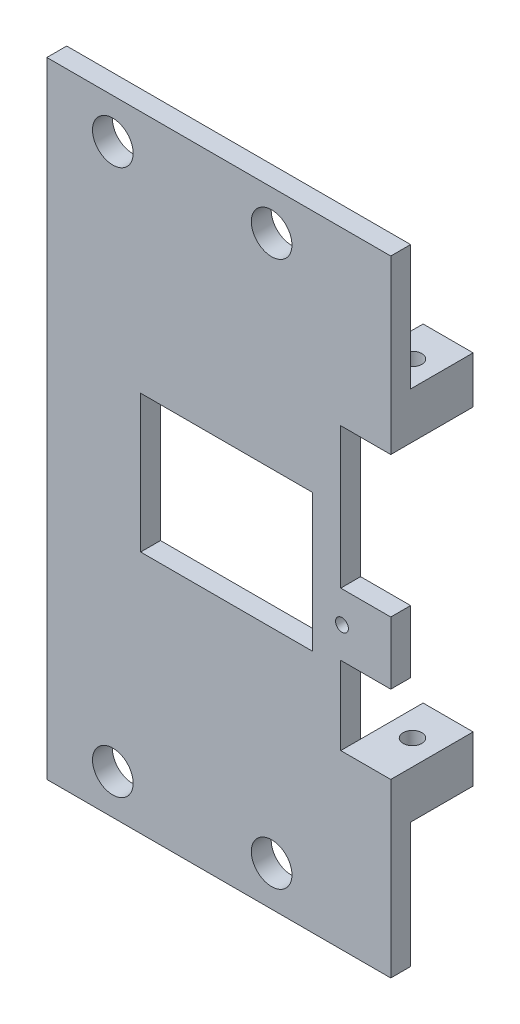
from build123d import *

# Parameters (mm, degrees)
SKETCH1_W           = 55
SKETCH1_H           = 100
SKETCH1_W_2         = 27.5
SKETCH1_H_2         = 22
BOSS_EXTRUDE1_DEPTH = 3.175
SKETCH2_W           = 8
SKETCH2_H           = 60
BOSS_EXTRUDE2_DEPTH = 10
SKETCH3_W           = 8
SKETCH3_H           = 45
CUT_EXTRUDE1_DEPTH  = 10
SKETCH4_R           = 1.5
CUT_EXTRUDE2_DEPTH  = 119.348003785
SKETCH5_R           = 3.25
CUT_EXTRUDE3_DEPTH  = 108.993055332
SKETCH7_W           = 8
SKETCH7_H           = 45
CUT_EXTRUDE5_DEPTH  = 108.993055332
SKETCH8_W           = 3.175
SKETCH8_H           = 10
BOSS_EXTRUDE4_DEPTH = 8
SKETCH9_R           = 1.025
CUT_EXTRUDE6_DEPTH  = 108.993055332


with BuildPart() as part:
    # Sketch1 → Boss-Extrude1 (new body)
    with BuildSketch(Plane.XY):
        with Locations((35, -37.5)):
            Rectangle(SKETCH1_W, SKETCH1_H)
        with Locations((36.25, -37.5)):
            Rectangle(SKETCH1_W_2, SKETCH1_H_2, mode=Mode.SUBTRACT)
    extrude(amount=BOSS_EXTRUDE1_DEPTH)

    # Sketch2 → Boss-Extrude2 (add)
    with BuildSketch(Plane(origin=(0, 0, 0), x_dir=(-1, 0, 0), z_dir=(0, 0, -1))):
        with Locations((-58.5, -37.5)):
            Rectangle(SKETCH2_W, SKETCH2_H)
    extrude(amount=BOSS_EXTRUDE2_DEPTH)

    # Sketch3 → Cut-Extrude1 (cut)
    with BuildSketch(Plane(origin=(0, 0, -10), x_dir=(-1, 0, 0), z_dir=(0, 0, -1))):
        with Locations((-58.5, -37.5)):
            Rectangle(SKETCH3_W, SKETCH3_H)
    extrude(amount=-CUT_EXTRUDE1_DEPTH, mode=Mode.SUBTRACT)

    # Sketch4 → Cut-Extrude2 (cut, through all)
    with BuildSketch(Plane(origin=(0, 12.5, 0), x_dir=(1, 0, 0), z_dir=(0, 1, 0))):
        with Locations(Location((58.5, 4.3, 0), (0, 0, 270))):
            Circle(SKETCH4_R)
    extrude(amount=-CUT_EXTRUDE2_DEPTH, mode=Mode.SUBTRACT)

    # Sketch5 → Cut-Extrude3 (cut, through all)
    with BuildSketch(Plane(origin=(0, 0, 0), x_dir=(-1, 0, 0), z_dir=(0, 0, -1))):
        with Locations((-43.45, -81.125)):
            Circle(SKETCH5_R)
        with Locations((-18.05, -81.125)):
            Circle(SKETCH5_R)
        with Locations((-18.05, 6.125)):
            Circle(SKETCH5_R)
        with Locations((-43.45, 6.125)):
            Circle(SKETCH5_R)
    extrude(amount=-CUT_EXTRUDE3_DEPTH, mode=Mode.SUBTRACT)

    # Sketch7 → Cut-Extrude5 (cut, through all)
    with BuildSketch(Plane(origin=(0, 0, 0), x_dir=(-1, 0, 0), z_dir=(0, 0, -1))):
        with Locations((-58.5, -37.5)):
            Rectangle(SKETCH7_W, SKETCH7_H)
    extrude(amount=-CUT_EXTRUDE5_DEPTH, mode=Mode.SUBTRACT)

    # Sketch8 → Boss-Extrude4 (add)
    with BuildSketch(Plane(origin=(54.5, 0, 0), x_dir=(0, 0, -1), z_dir=(1, 0, 0))):
        with Locations((-1.5875, -42.5)):
            Rectangle(SKETCH8_W, SKETCH8_H)
    extrude(amount=BOSS_EXTRUDE4_DEPTH)

    # Sketch9 → Cut-Extrude6 (cut, through all)
    with BuildSketch(Plane(origin=(0, 0, 0), x_dir=(-1, 0, 0), z_dir=(0, 0, -1))):
        with Locations((-54.7, -42.5)):
            Circle(SKETCH9_R)
    extrude(amount=-CUT_EXTRUDE6_DEPTH, mode=Mode.SUBTRACT)


solid = part.part
